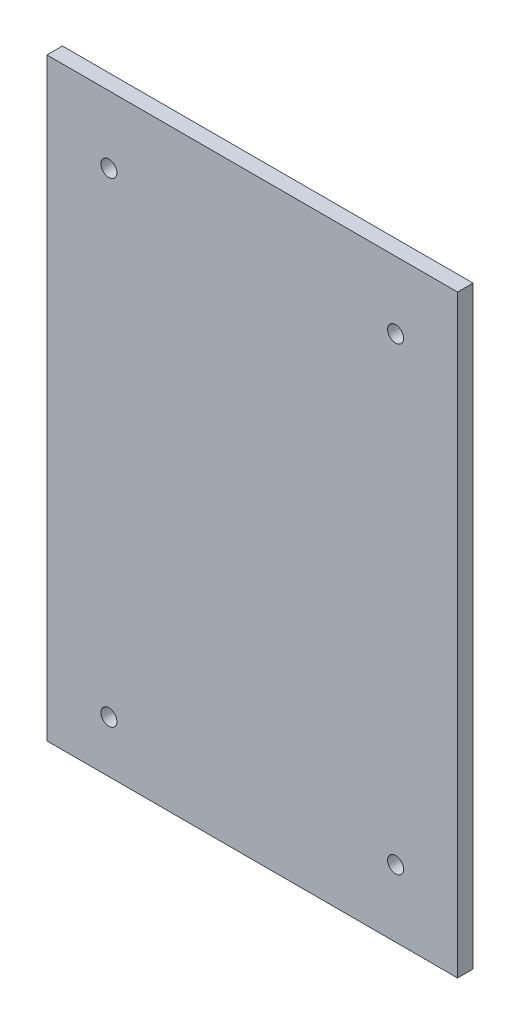
from build123d import *

# Parameters (mm, degrees)
SKETCH1_W           = 79.5
SKETCH1_H           = 115
SKETCH1_R           = 1.55
BOSS_EXTRUDE1_DEPTH = 3


with BuildPart() as part:
    # Sketch1 → Boss-Extrude1 (new body)
    with BuildSketch(Plane.XY):
        Rectangle(SKETCH1_W, SKETCH1_H)
        with Locations((-27.75, 44.5)):
            Circle(SKETCH1_R, mode=Mode.SUBTRACT)
        with Locations((27.75, 44.5)):
            Circle(SKETCH1_R, mode=Mode.SUBTRACT)
        with Locations(Location((27.75, -44.5, 0), (0, 0, 180))):
            Circle(SKETCH1_R, mode=Mode.SUBTRACT)
        with Locations(Location((-27.75, -47.5, 0), (0, 0, 180))):
            Circle(SKETCH1_R, mode=Mode.SUBTRACT)
    extrude(amount=BOSS_EXTRUDE1_DEPTH)


solid = part.part
